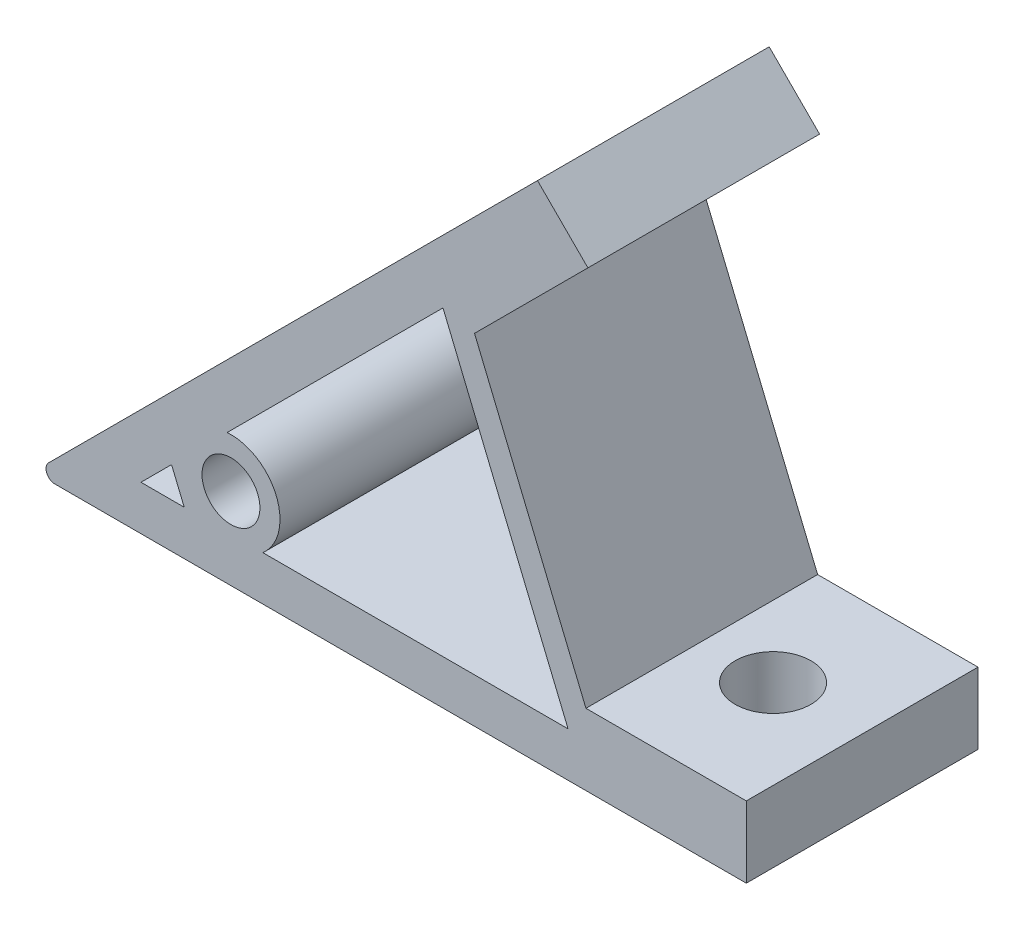
from build123d import *

# Parameters (mm, degrees)
SKETCH_1_R          = 3.25
EXTRUDE_1_DEPTH     = 13
SKETCH_3_R          = 4.25
CUT_EXTRUDE_1_DEPTH = 17


with BuildPart() as part:
    # 草图1 → 凸台-拉伸1 (new, symmetric)
    with BuildSketch(Plane.XY):
        with BuildLine():
            Line((-77.585786438, 0), (0, 0))
            Line((0, 0), (0, 8))
            Line((0, 8), (-17.995464086, 8))
            Line((-17.995464086, 8), (-30.499317942, 38.186973559))
            Line((-30.499317942, 38.186973559), (-17.774603256, 50.911688245))
            Line((-17.774603256, 50.911688245), (-23.431457505, 56.568542495))
            Line((-23.431457505, 56.568542495), (-78.292893219, 1.707106781))
            ThreePointArc((-78.292893219, 1.707106781), (-78.50966597, 0.617316568), (-77.585786438, 0))
        make_face()
        with Locations(Location((-57.82689122, 9.184402377, 0), (0, 0, 180))):
            Circle(SKETCH_1_R, mode=Mode.SUBTRACT)
        Polygon((-67.928932188, 5), (-63.07447047, 5), (-64.496309389, 8.4326228), align=None, mode=Mode.SUBTRACT)
        with BuildLine():
            Line((-54.257468753, 5), (-20, 5))
            Line((-20, 5), (-34.038059223, 38.890872965))
            Line((-34.038059223, 38.890872965), (-58.261747684, 14.667184504))
            ThreePointArc((-58.261747684, 14.667184504), (-52.745553791, 11.289161255), (-54.257468753, 5))
        make_face(mode=Mode.SUBTRACT)
    extrude(amount=EXTRUDE_1_DEPTH, both=True)

    # 草图3 → 切除-拉伸1 (cut)
    with BuildSketch(Plane(origin=(0, 8, 0), x_dir=(1, 0, 0), z_dir=(0, 1, 0))):
        with Locations(Location((-10, 0, 0), (0, 0, 180))):
            Circle(SKETCH_3_R)
    cut_extrude_1 = extrude(amount=-CUT_EXTRUDE_1_DEPTH, mode=Mode.SUBTRACT)

    # 镜向1: 切除-拉伸1 across plane
    add(cut_extrude_1.mirror(Plane(origin=(-11.715728753, 28.284271247, 0), x_dir=(0, 0, 1), z_dir=(-0.3826834323650881, 0.9238795325112875, 0))), mode=Mode.SUBTRACT)


solid = part.part
